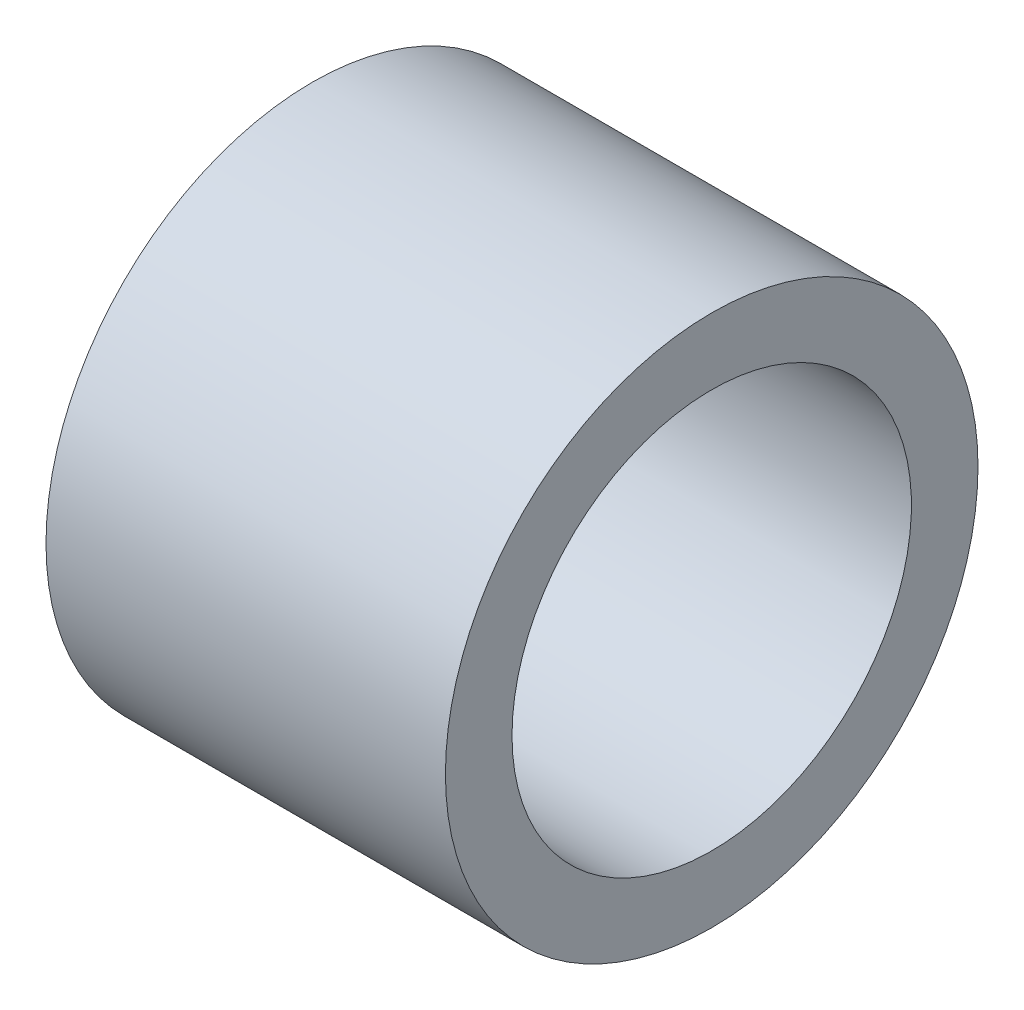
from build123d import *

# Parameters (mm, degrees)
SKETCH1_R           = 12.7
SKETCH1_R_2         = 9.525
BOSS_EXTRUDE1_DEPTH = 9.525


with BuildPart() as part:
    # Sketch1 → Boss-Extrude1 (new, symmetric)
    with BuildSketch(Plane(origin=(0, 0, 0), x_dir=(0, 0, -1), z_dir=(1, 0, 0))):
        with Locations(Location((0, 0, 0), (0, 0, 180))):
            Circle(SKETCH1_R)
        with Locations(Location((0, 0, 0), (0, 0, 180))):
            Circle(SKETCH1_R_2, mode=Mode.SUBTRACT)
    extrude(amount=BOSS_EXTRUDE1_DEPTH, both=True)


solid = part.part
